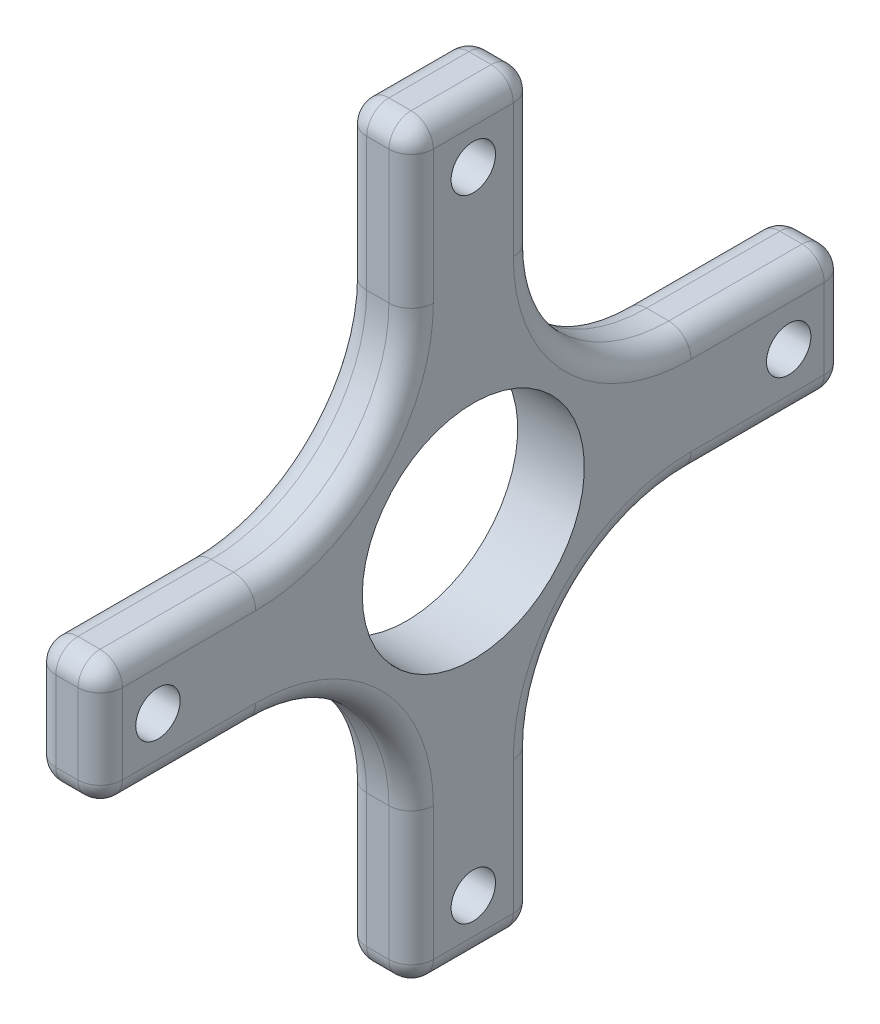
from build123d import *

# Parameters (mm, degrees)
SKETCH1_R           = 1
SKETCH1_R_2         = 5
BOSS_EXTRUDE1_DEPTH = 3
FILLET1_R           = 1
FILLET3_R           = 1


with BuildPart() as part:
    # Sketch1 → Boss-Extrude1 (new body)
    with BuildSketch(Plane.ZY.offset(-664.925949728)):
        with BuildLine():
            Line((1323.317943891, 920.63265885), (1328.917943891, 920.63265885))
            Line((1328.917943891, 920.63265885), (1328.917943891, 913.632658853))
            ThreePointArc((1328.917943891, 913.632658853), (1330.968196422, 908.682911384), (1335.917943891, 906.632658853))
            Line((1335.917943891, 906.632658853), (1342.917943891, 906.632658853))
            Line((1342.917943891, 906.632658853), (1342.917943891, 901.03265885))
            Line((1342.917943891, 901.03265885), (1335.917943891, 901.03265885))
            ThreePointArc((1335.917943891, 901.03265885), (1330.968196422, 898.982406318), (1328.917943891, 894.03265885))
            Line((1328.917943891, 894.03265885), (1328.917943891, 887.03265885))
            Line((1328.917943891, 887.03265885), (1323.317943893, 887.03265885))
            Line((1323.317943893, 887.03265885), (1323.317943893, 894.03265885))
            ThreePointArc((1323.317943893, 894.03265885), (1321.267691361, 898.982406318), (1316.317943893, 901.03265885))
            Line((1316.317943893, 901.03265885), (1309.317943891, 901.03265885))
            Line((1309.317943891, 901.03265885), (1309.317943891, 906.632658853))
            Line((1309.317943891, 906.632658853), (1316.317943891, 906.632658853))
            ThreePointArc((1316.317943891, 906.632658853), (1321.267691359, 908.682911384), (1323.317943891, 913.632658853))
            Line((1323.317943891, 913.632658853), (1323.317943891, 920.63265885))
        make_face()
        with Locations((1326.117943891, 918.03265885)):
            Circle(SKETCH1_R, mode=Mode.SUBTRACT)
        with Locations((1311.917943891, 903.832658851)):
            Circle(SKETCH1_R, mode=Mode.SUBTRACT)
        with Locations((1340.317943891, 903.832658851)):
            Circle(SKETCH1_R, mode=Mode.SUBTRACT)
        with Locations((1326.117943892, 889.63265885)):
            Circle(SKETCH1_R, mode=Mode.SUBTRACT)
        with Locations((1326.117943891, 903.83265885)):
            Circle(SKETCH1_R_2, mode=Mode.SUBTRACT)
    extrude(amount=BOSS_EXTRUDE1_DEPTH)

    # Fillet1
    fillet1_edges = [part.edges().sort_by_distance(p)[0] for p in [
        (663.425949728, 920.63265885, 1323.317943891),
        (663.425949728, 920.63265885, 1328.917943891),
        (663.425949728, 906.632658853, 1342.917943891),
        (663.425949728, 901.03265885, 1342.917943891),
        (663.425949728, 887.03265885, 1328.917943891),
        (663.425949728, 887.03265885, 1323.317943893),
        (663.425949728, 901.03265885, 1309.317943891),
        (663.425949728, 906.632658853, 1309.317943891),
    ]]
    fillet(fillet1_edges, radius=FILLET1_R)

    # Fillet3
    fillet3_edges = [part.edges().sort_by_distance(p)[0] for p in [
        (661.925949728, 906.632658853, 1313.317943891),
        (664.925949728, 916.632658851, 1328.917943891),
        (664.925949728, 908.682911384, 1330.968196422),
        (664.925949728, 901.03265885, 1338.917943891),
        (664.925949728, 898.982406318, 1330.968196422),
        (664.925949728, 891.03265885, 1323.317943893),
        (664.925949728, 898.982406318, 1321.267691361),
        (664.925949728, 906.632658853, 1313.317943891),
        (664.925949728, 908.682911384, 1321.267691359),
        (661.925949728, 898.982406318, 1321.267691361),
        (661.925949728, 891.03265885, 1323.317943893),
        (661.925949728, 898.982406318, 1330.968196422),
        (661.925949728, 901.03265885, 1338.917943891),
        (661.925949728, 908.682911384, 1330.968196422),
        (661.925949728, 916.632658851, 1328.917943891),
        (664.925949728, 906.632658853, 1338.917943891),
        (661.925949728, 906.632658853, 1338.917943891),
        (664.925949728, 916.632658851, 1323.317943891),
        (664.925949728, 920.63265885, 1326.117943891),
        (664.925949728, 903.832658851, 1342.917943891),
        (664.925949728, 891.03265885, 1328.917943891),
        (664.925949728, 887.03265885, 1326.117943892),
        (664.925949728, 901.03265885, 1313.317943892),
        (664.925949728, 903.832658851, 1309.317943891),
        (664.925949728, 920.339765631, 1328.625050672),
        (664.925949728, 906.339765634, 1309.610837109),
        (664.925949728, 920.339765631, 1323.610837109),
        (664.925949728, 901.325552068, 1309.610837109),
        (664.925949728, 887.325552069, 1323.610837112),
        (664.925949728, 887.325552069, 1328.625050672),
        (664.925949728, 901.325552068, 1342.625050672),
        (664.925949728, 906.339765634, 1342.625050672),
        (661.925949728, 903.832658851, 1342.917943891),
        (661.925949728, 916.632658851, 1323.317943891),
        (661.925949728, 903.832658851, 1309.317943891),
        (661.925949728, 901.03265885, 1313.317943892),
        (661.925949728, 887.03265885, 1326.117943892),
        (661.925949728, 891.03265885, 1328.917943891),
        (661.925949728, 920.63265885, 1326.117943891),
        (661.925949728, 920.339765631, 1328.625050672),
        (661.925949728, 906.339765634, 1309.610837109),
        (661.925949728, 920.339765631, 1323.610837109),
        (661.925949728, 901.325552068, 1309.610837109),
        (661.925949728, 887.325552069, 1323.610837112),
        (661.925949728, 887.325552069, 1328.625050672),
        (661.925949728, 901.325552068, 1342.625050672),
        (661.925949728, 906.339765634, 1342.625050672),
        (661.925949728, 908.682911384, 1321.267691359),
    ]]
    fillet(fillet3_edges, radius=FILLET3_R)


solid = part.part
